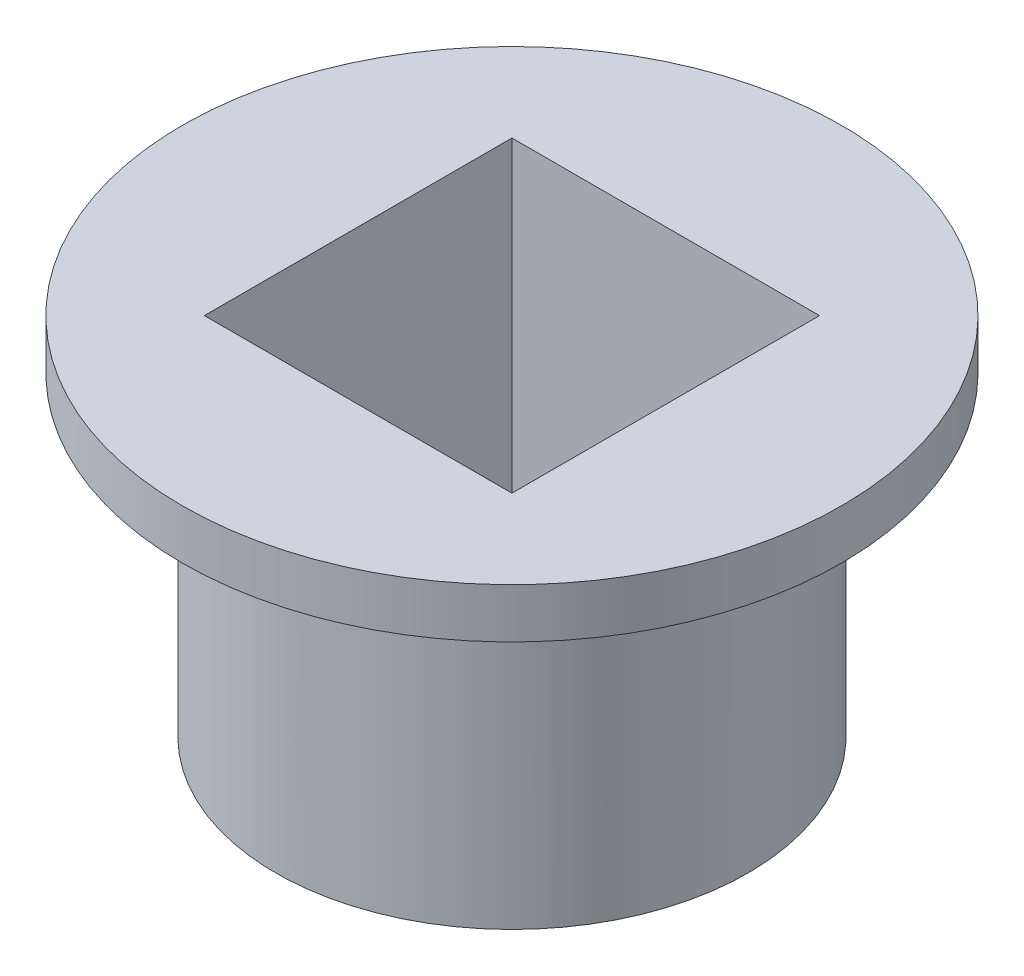
from build123d import *

# Parameters (mm, degrees)
SKETCH1_R           = 9.525
SKETCH1_W           = 12.4
SKETCH1_H           = 12.4
BOSS_EXTRUDE1_DEPTH = 12.70000008
BOSS_EXTRUDE3_START = -2
SKETCH2_R           = 13.2875
SKETCH2_R_2         = 9.525
BOSS_EXTRUDE3_DEPTH = 2
BOSS_EXTRUDE4_START = 2
SKETCH3_R           = 9.525
SKETCH3_R_2         = 4.7
BOSS_EXTRUDE4_DEPTH = 2


with BuildPart() as part:
    # Sketch1 → Boss-Extrude1 (new body)
    with BuildSketch(Plane(origin=(0, 0, 0), x_dir=(1, 0, 0), z_dir=(0, 1, 0))):
        with Locations(Location((0, 0, 0), (0, 0, 270))):
            Circle(SKETCH1_R)
        Rectangle(SKETCH1_W, SKETCH1_H, mode=Mode.SUBTRACT)
    extrude(amount=BOSS_EXTRUDE1_DEPTH)

    # Sketch2 → Boss-Extrude3 (add)
    with BuildSketch(Plane(origin=(0, 12.70000008, 0), x_dir=(1, 0, 0), z_dir=(0, 1, 0)).offset(BOSS_EXTRUDE3_START)):
        with Locations(Location((0, 0, 0), (0, 0, 270))):
            Circle(SKETCH2_R)
        with Locations(Location((0, 0, 0), (0, 0, 270))):
            Circle(SKETCH2_R_2, mode=Mode.SUBTRACT)
    extrude(amount=BOSS_EXTRUDE3_DEPTH)

    # Sketch3 → Boss-Extrude4 (add)
    with BuildSketch(Plane.XZ.offset(BOSS_EXTRUDE4_START)):
        with Locations(Location((0, 0, 0), (0, 0, 270))):
            Circle(SKETCH3_R)
        with Locations(Location((0, 0, 0), (0, 0, 270))):
            Circle(SKETCH3_R_2, mode=Mode.SUBTRACT)
    extrude(amount=-BOSS_EXTRUDE4_DEPTH)


solid = part.part
